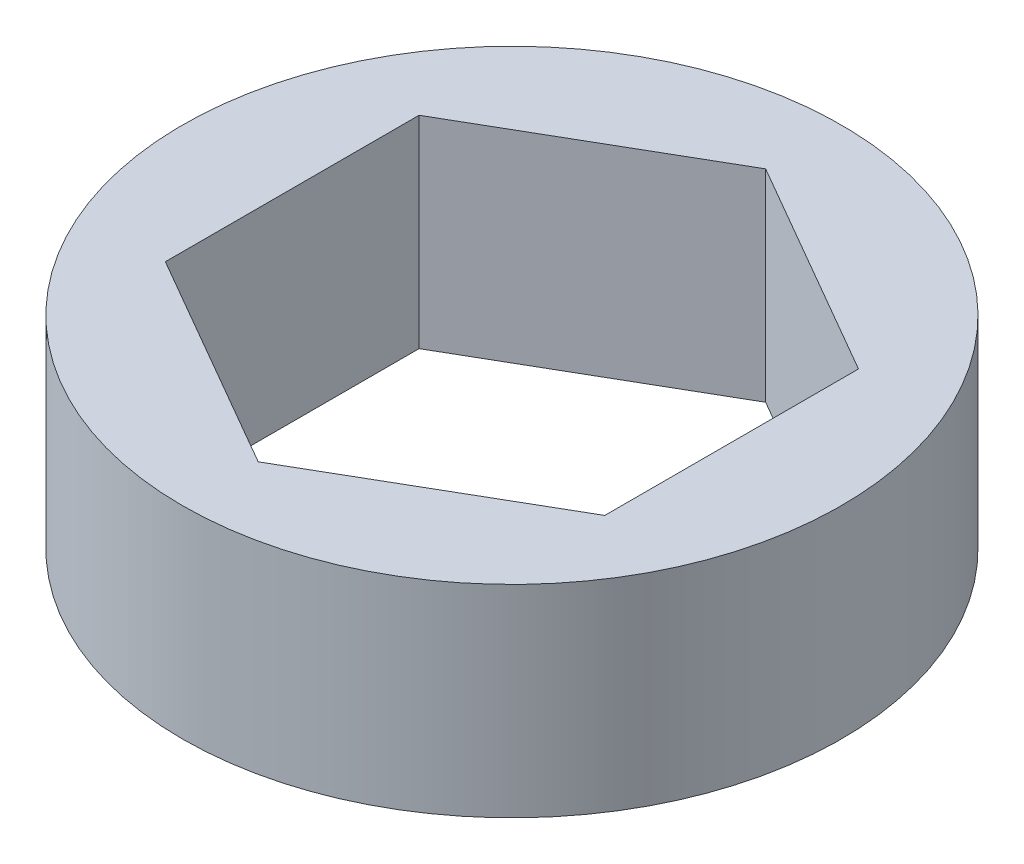
from build123d import *

# Parameters (mm, degrees)
SKETCH1_R           = 9.525
BOSS_EXTRUDE1_DEPTH = 5.842


with BuildPart() as part:
    # Sketch1 → Boss-Extrude1 (new body)
    with BuildSketch(Plane(origin=(0, 0, 0), x_dir=(1, 0, 0), z_dir=(0, 1, 0))):
        with Locations(Location((0, 0, 0), (0, 0, 270))):
            Circle(SKETCH1_R)
        Polygon((0, 7.332348419), (-6.35, 3.666174209), (-6.35, -3.666174209), (0, -7.332348419), (6.35, -3.666174209), (6.35, 3.666174209), align=None, mode=Mode.SUBTRACT)
    extrude(amount=BOSS_EXTRUDE1_DEPTH)


solid = part.part
